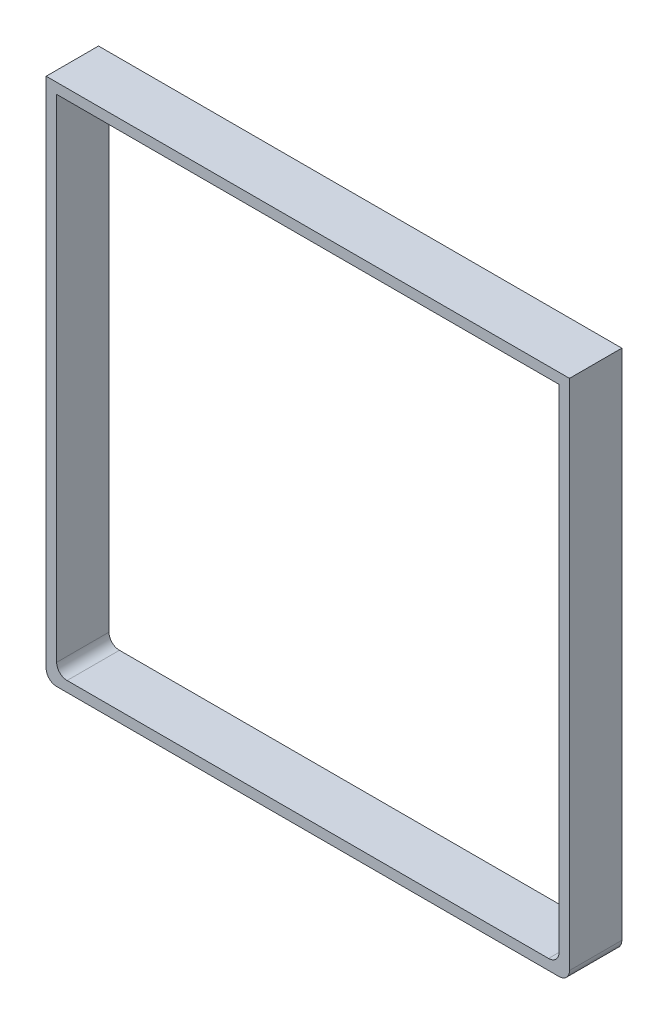
from build123d import *

# Parameters (mm, degrees)
SALIENTE_EXTRUIR1_DEPTH = 50


with BuildPart() as part:
    # Croquis2 → Saliente-Extruir1 (new body)
    with BuildSketch(Plane.XY):
        with BuildLine():
            Line((0, 10), (0, 500))
            Line((0, 500), (500, 500))
            Line((500, 500), (500, 10))
            ThreePointArc((500, 10), (497.071067812, 2.928932188), (490, 0))
            Line((490, 0), (10, 0))
            ThreePointArc((10, 0), (2.928932188, 2.928932188), (0, 10))
        make_face()
        with BuildLine():
            Line((10, 490), (10, 20))
            ThreePointArc((10, 20), (12.928932188, 12.928932188), (20, 10))
            Line((20, 10), (480, 10))
            ThreePointArc((480, 10), (487.071067812, 12.928932188), (490, 20))
            Line((490, 20), (490, 490))
            Line((490, 490), (10, 490))
        make_face(mode=Mode.SUBTRACT)
    extrude(amount=SALIENTE_EXTRUIR1_DEPTH)


solid = part.part
